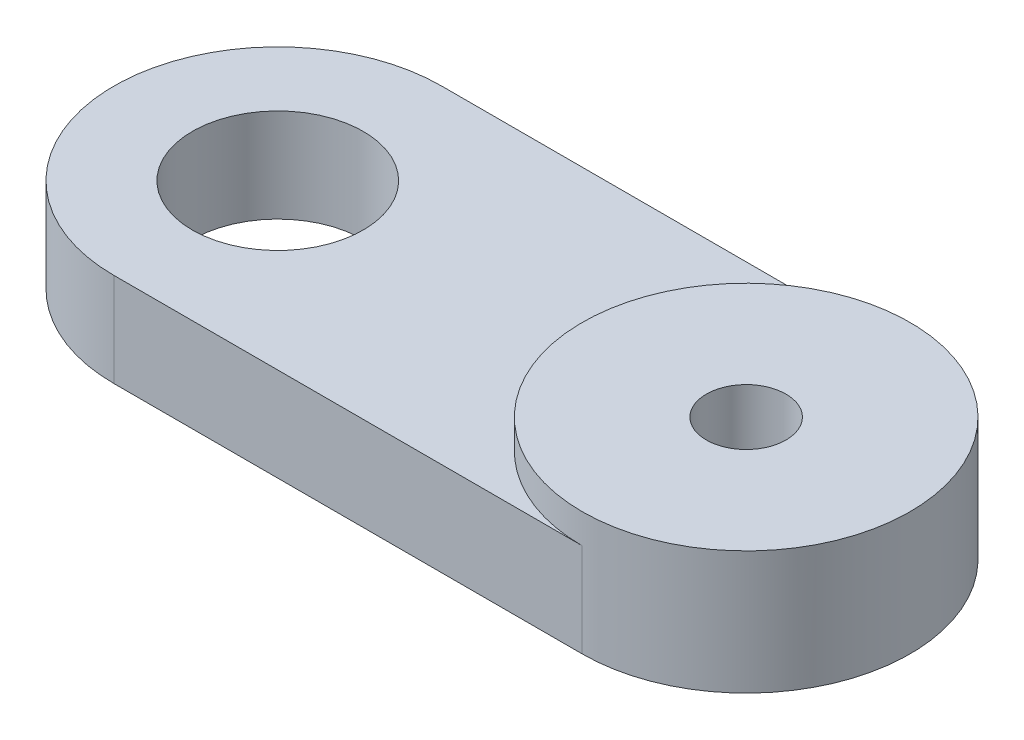
from build123d import *

# Parameters (mm, degrees)
SKETCH1_R             = 2.31775
SKETCH1_R_2           = 1.0795
BASE_EXTRUDE_DEPTH    = 2.54
SKETCH2_R             = 4.445
SKETCH2_R_2           = 1.0795
SERVO_EXTRUDE_DEPTH   = 0.8
SKETCH3_R             = 2.794
SKETCH3_R_2           = 1.0795
SERVO_MOUNT_CUT_DEPTH = 1.816


with BuildPart() as part:
    # Sketch1 → Base Extrude (new body)
    with BuildSketch(Plane(origin=(0, 0, 0), x_dir=(1, 0, 0), z_dir=(0, 1, 0))):
        with BuildLine():
            ThreePointArc((0, 4.445), (-4.445, 0), (0, -4.445))
            Line((0, -4.445), (12.7, -4.445))
            ThreePointArc((12.7, -4.445), (17.145, 0), (12.7, 4.445))
            Line((12.7, 4.445), (0, 4.445))
        make_face()
        with Locations(Location((0, 0, 0), (0, 0, 270))):
            Circle(SKETCH1_R, mode=Mode.SUBTRACT)
        with Locations(Location((12.7, 0, 0), (0, 0, 270))):
            Circle(SKETCH1_R_2, mode=Mode.SUBTRACT)
    extrude(amount=BASE_EXTRUDE_DEPTH)

    # Sketch2 → Servo Extrude (add)
    with BuildSketch(Plane(origin=(0, 2.54, 0), x_dir=(1, 0, 0), z_dir=(0, 1, 0))):
        with Locations(Location((12.7, 0, 0), (0, 0, 270))):
            Circle(SKETCH2_R)
        with Locations(Location((12.7, 0, 0), (0, 0, 270))):
            Circle(SKETCH2_R_2, mode=Mode.SUBTRACT)
    extrude(amount=SERVO_EXTRUDE_DEPTH)

    # Sketch3 → Servo Mount Cut (cut)
    with BuildSketch(Plane.XZ):
        with Locations(Location((12.7, 0, 0), (0, 0, 270))):
            Circle(SKETCH3_R)
        with Locations(Location((12.7, 0, 0), (0, 0, 90))):
            Circle(SKETCH3_R_2, mode=Mode.SUBTRACT)
    extrude(amount=-SERVO_MOUNT_CUT_DEPTH, mode=Mode.SUBTRACT)


solid = part.part
